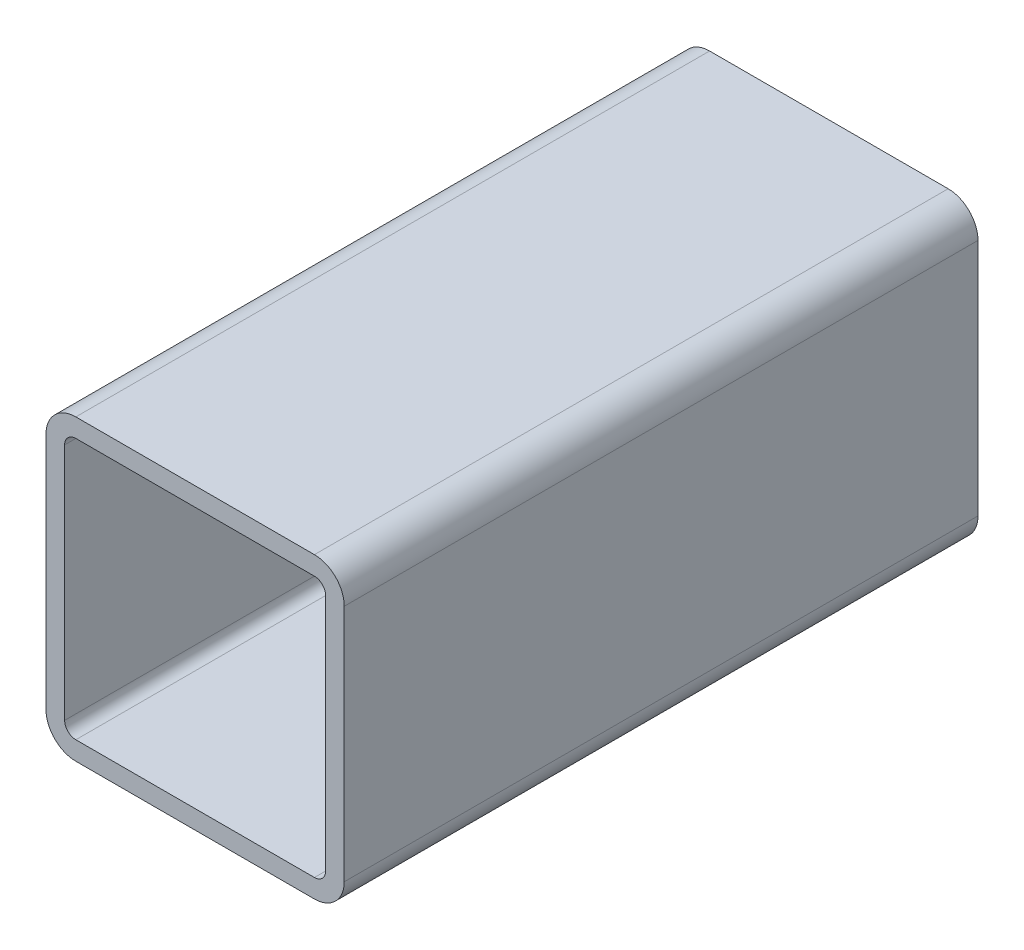
from build123d import *

# Parameters (mm, degrees)
DODANIE_WYCI_GNI_CIE1_DEPTH = 170


with BuildPart() as part:
    # Szkic1 → Dodanie-wyciągnięcie1 (new body)
    with BuildSketch(Plane.XY):
        with BuildLine():
            Line((-8, 0), (-72, 0))
            ThreePointArc((-72, 0), (-77.656854249, 2.343145751), (-80, 8))
            Line((-80, 8), (-80, 72))
            ThreePointArc((-80, 72), (-77.656854249, 77.656854249), (-72, 80))
            Line((-72, 80), (-8, 80))
            ThreePointArc((-8, 80), (-2.343145751, 77.656854249), (0, 72))
            Line((0, 72), (0, 8))
            ThreePointArc((0, 8), (-2.343145751, 2.343145751), (-8, 0))
        make_face()
        with BuildLine():
            Line((-5, 8), (-5, 72))
            ThreePointArc((-5, 72), (-5.878679656, 74.121320344), (-8, 75))
            Line((-8, 75), (-72, 75))
            ThreePointArc((-72, 75), (-74.121320344, 74.121320344), (-75, 72))
            Line((-75, 72), (-75, 8))
            ThreePointArc((-75, 8), (-74.121320344, 5.878679656), (-72, 5))
            Line((-72, 5), (-8, 5))
            ThreePointArc((-8, 5), (-5.878679656, 5.878679656), (-5, 8))
        make_face(mode=Mode.SUBTRACT)
    extrude(amount=DODANIE_WYCI_GNI_CIE1_DEPTH)


solid = part.part
